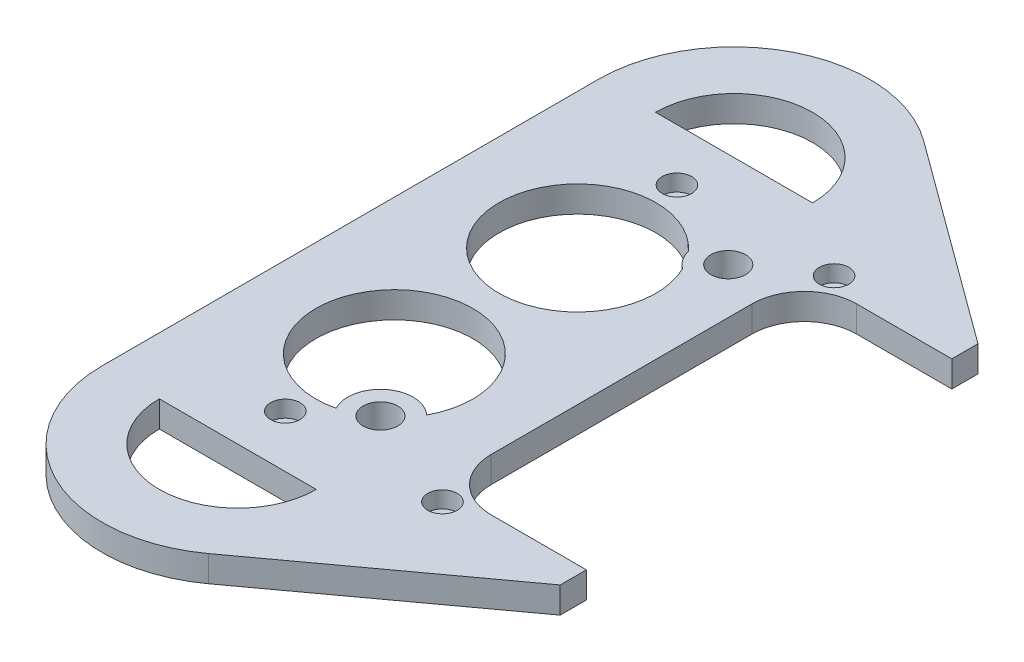
from build123d import *

# Parameters (mm, degrees)
BOSS_EXTRUDE1_DEPTH                            = 6.35
FILLET1_R                                      = 12.7
TAP_DRILL_FOR_3_8_24_TAP1_D                    = 8.4328
CBORE_FOR_6_SOCKET_HEAD_CAP_SCREW1_D           = 3.7973
CBORE_FOR_6_SOCKET_HEAD_CAP_SCREW1_CBORE_D     = 7.14502
CBORE_FOR_6_SOCKET_HEAD_CAP_SCREW1_CBORE_DEPTH = 4.0132


with BuildPart() as part:
    # Sketch1 → Boss-Extrude1 (new body)
    with BuildSketch(Plane(origin=(0, 53.278467802, 0), x_dir=(1, 0, 0), z_dir=(0, 1, 0))):
        with BuildLine():
            ThreePointArc((-14.919754069, 137.471595351), (-49.255675468, 140.270872374), (-67.283137827, 110.914407139))
            Line((-67.283137827, 110.914407139), (-67.283137827, -9.525))
            ThreePointArc((-67.283137827, -9.525), (-49.255676138, -38.881464895), (-14.919755281, -36.0821891))
            Line((-14.919755281, -36.0821891), (34.354322218, 0))
            Line((34.354322218, 0), (34.354322218, 6.35))
            Line((34.354322218, 6.35), (-1.450719122, 6.35))
            Line((-1.450719122, 6.35), (-1.450719122, 95.039403682))
            Line((-1.450719122, 95.039403682), (34.354322218, 95.039403682))
            Line((34.354322218, 95.039403682), (34.354322218, 101.389403682))
            Line((34.354322218, 101.389403682), (-14.919754069, 137.471595351))
        make_face()
        with BuildLine():
            Line((-53.416928475, -9.525), (-34.366928475, -9.525))
            Line((-34.366928475, -9.525), (-15.316928475, -9.525))
            ThreePointArc((-15.316928475, -9.525), (-34.366928475, -28.575), (-53.416928475, -9.525))
        make_face(mode=Mode.SUBTRACT)
        with BuildLine():
            ThreePointArc((-29.961916932, 9.935994461), (-46.001401892, 43.554183286), (-17.560004644, 19.501436661))
            ThreePointArc((-17.560004644, 19.501436661), (-27.817615961, 19.978303209), (-29.961916932, 9.935994461))
        make_face(mode=Mode.SUBTRACT)
        with BuildLine():
            ThreePointArc((-17.256926776, 81.295283661), (-50.136649325, 62.232402493), (-20.247770765, 85.708444148))
            ThreePointArc((-20.247770765, 85.708444148), (-19.133936144, 83.24325824), (-17.256926776, 81.295283661))
        make_face(mode=Mode.SUBTRACT)
        with BuildLine():
            Line((-34.366928475, 110.914407139), (-53.416928475, 110.914407139))
            ThreePointArc((-53.416928475, 110.914407139), (-34.366928475, 129.964407139), (-15.316928475, 110.914407139))
            Line((-15.316928475, 110.914407139), (-34.366928475, 110.914407139))
        make_face(mode=Mode.SUBTRACT)
    extrude(amount=BOSS_EXTRUDE1_DEPTH)

    # Fillet1
    fillet1_edges = [part.edges().sort_by_distance(p)[0] for p in [
        (-1.450719122, 56.453467802, -6.35),
        (-1.450719122, 56.453467802, -95.039403682),
    ]]
    fillet(fillet1_edges, radius=FILLET1_R)

    # Tap Drill for 3/8-24 Tap1 (through all)
    with Locations(Plane(origin=(0, 59.628467802, 0), x_dir=(1, 0, 0), z_dir=(0, 1, 0))):
        with Locations((-22.969918704, 13.693103328), (-12.563219122, 87.696300355)):
            Hole(TAP_DRILL_FOR_3_8_24_TAP1_D / 2)

    # CBORE for #6 Socket Head Cap Screw1 (through all)
    with Locations(Plane(origin=(0, 59.628467802, 0), x_dir=(1, 0, 0), z_dir=(0, 1, 0))):
        with Locations((2.604322218, 3.175), (-35.533137827, 3.175), (-35.533137827, 98.214403682), (2.604322218, 98.214403682)):
            CounterBoreHole(CBORE_FOR_6_SOCKET_HEAD_CAP_SCREW1_D / 2, CBORE_FOR_6_SOCKET_HEAD_CAP_SCREW1_CBORE_D / 2, CBORE_FOR_6_SOCKET_HEAD_CAP_SCREW1_CBORE_DEPTH)


solid = part.part
